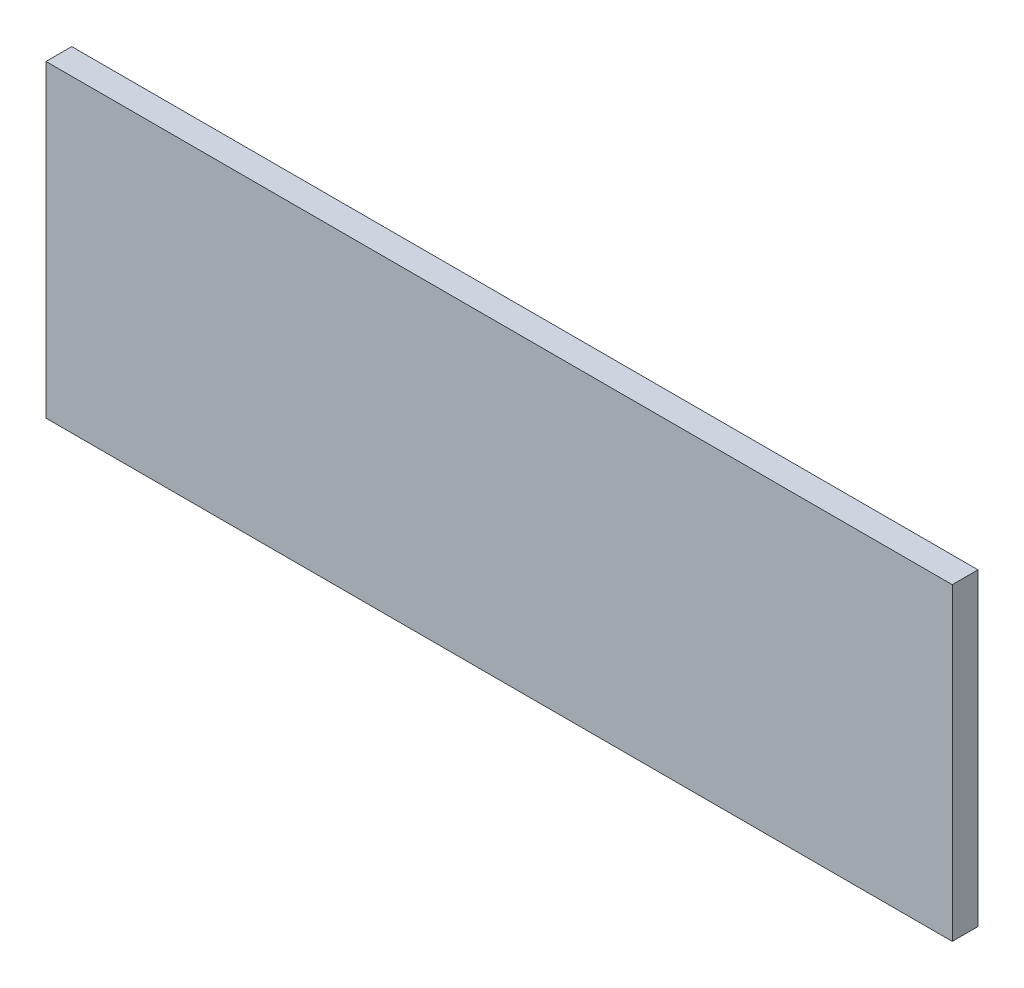
from build123d import *

# Parameters (mm, degrees)
SKETCH1_W           = 176
SKETCH1_H           = 60
BOSS_EXTRUDE1_DEPTH = 5


with BuildPart() as part:
    # Sketch1 → Boss-Extrude1 (new body)
    with BuildSketch(Plane.XY):
        Rectangle(SKETCH1_W, SKETCH1_H)
    extrude(amount=BOSS_EXTRUDE1_DEPTH)


solid = part.part
